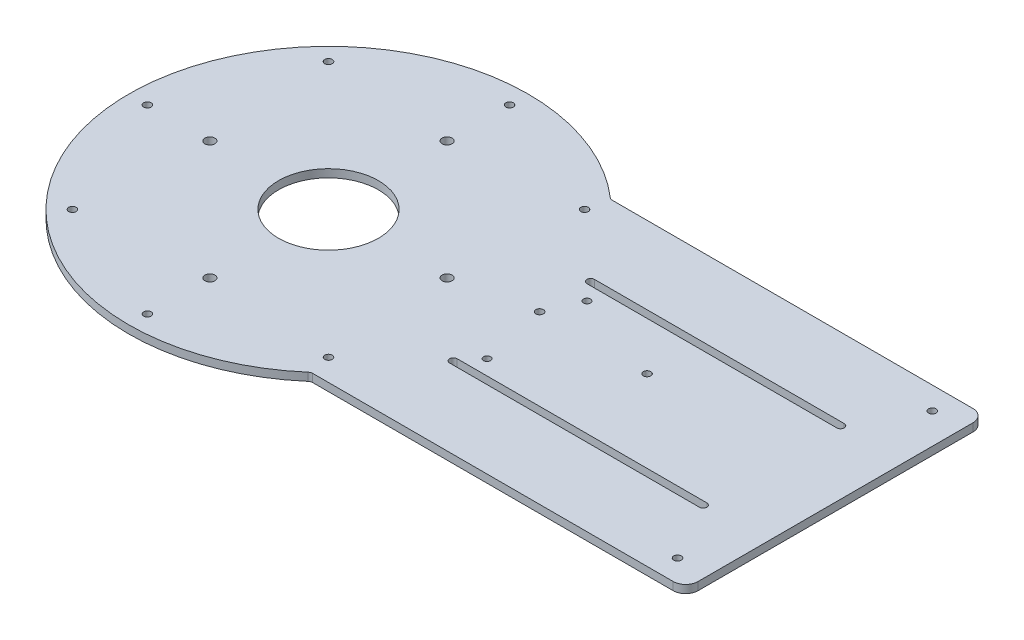
from build123d import *

# Parameters (mm, degrees)
SKETCH1_R           = 20
SKETCH1_R_2         = 1.5
SKETCH1_R_3         = 2
SKETCH1_R_4         = 1.4
BOSS_EXTRUDE1_DEPTH = 3.2


with BuildPart() as part:
    # Sketch1 → Boss-Extrude1 (new body)
    with BuildSketch(Plane(origin=(0, 0, 0), x_dir=(1, 0, 0), z_dir=(0, 1, 0))):
        with BuildLine():
            Line((283, 55), (283, -55))
            ThreePointArc((283, -55), (281.535533906, -58.535533906), (278, -60))
            Line((278, -60), (133.66563146, -60))
            ThreePointArc((133.66563146, -60), (132.967201164, -60.125914857), (132.35671362, -60.487804878))
            ThreePointArc((132.35671362, -60.487804878), (0, 0), (132.35671362, 60.487804878))
            ThreePointArc((132.35671362, 60.487804878), (132.967201164, 60.125914857), (133.66563146, 60))
            Line((133.66563146, 60), (278, 60))
            ThreePointArc((278, 60), (281.535533906, 58.535533906), (283, 55))
        make_face()
        with Locations(Location((80, 0, 0), (0, 0, 270))):
            Circle(SKETCH1_R, mode=Mode.SUBTRACT)
        with Locations(Location((7.5, 0, 0), (0, 0, 270))):
            Circle(SKETCH1_R_2, mode=Mode.SUBTRACT)
        with Locations(Location((28.734758364, 51.265241636, 0), (0, 0, 270))):
            Circle(SKETCH1_R_2, mode=Mode.SUBTRACT)
        with Locations(Location((80, 72.5, 0), (0, 0, 270))):
            Circle(SKETCH1_R_2, mode=Mode.SUBTRACT)
        with Locations(Location((131.265241636, 51.265241636, 0), (0, 0, 270))):
            Circle(SKETCH1_R_2, mode=Mode.SUBTRACT)
        with Locations(Location((131.265241636, -51.265241636, 0), (0, 0, 270))):
            Circle(SKETCH1_R_2, mode=Mode.SUBTRACT)
        with Locations(Location((80, -72.5, 0), (0, 0, 270))):
            Circle(SKETCH1_R_2, mode=Mode.SUBTRACT)
        with Locations(Location((28.734758364, -51.265241636, 0), (0, 0, 270))):
            Circle(SKETCH1_R_2, mode=Mode.SUBTRACT)
        with Locations(Location((32.5, 0, 0), (0, 0, 270))):
            Circle(SKETCH1_R_3, mode=Mode.SUBTRACT)
        with Locations(Location((80, 47.5, 0), (0, 0, 270))):
            Circle(SKETCH1_R_3, mode=Mode.SUBTRACT)
        with Locations(Location((127.5, 0, 0), (0, 0, 270))):
            Circle(SKETCH1_R_3, mode=Mode.SUBTRACT)
        with Locations(Location((80, -47.5, 0), (0, 0, 270))):
            Circle(SKETCH1_R_3, mode=Mode.SUBTRACT)
        with Locations(Location((270.75, 51, 0), (0, 0, 270))):
            Circle(SKETCH1_R_2, mode=Mode.SUBTRACT)
        with Locations(Location((270.75, -51, 0), (0, 0, 270))):
            Circle(SKETCH1_R_2, mode=Mode.SUBTRACT)
        with Locations(Location((163.5, 20, 0), (0, 0, 270))):
            Circle(SKETCH1_R_4, mode=Mode.SUBTRACT)
        with Locations(Location((163.5, -20, 0), (0, 0, 270))):
            Circle(SKETCH1_R_4, mode=Mode.SUBTRACT)
        with Locations(Location((157.75, 6.8, 0), (0, 0, 270))):
            Circle(SKETCH1_R_2, mode=Mode.SUBTRACT)
        with Locations(Location((200.75, 6.8, 0), (0, 0, 270))):
            Circle(SKETCH1_R_2, mode=Mode.SUBTRACT)
        with BuildLine():
            Line((157.5, -29), (257.5, -29))
            ThreePointArc((257.5, -29), (259, -27.5), (257.5, -26))
            Line((257.5, -26), (157.5, -26))
            ThreePointArc((157.5, -26), (156, -27.5), (157.5, -29))
        make_face(mode=Mode.SUBTRACT)
        with BuildLine():
            Line((257.5, 26), (157.5, 26))
            ThreePointArc((157.5, 26), (156, 27.5), (157.5, 29))
            Line((157.5, 29), (257.5, 29))
            ThreePointArc((257.5, 29), (259, 27.5), (257.5, 26))
        make_face(mode=Mode.SUBTRACT)
    extrude(amount=BOSS_EXTRUDE1_DEPTH)


solid = part.part
